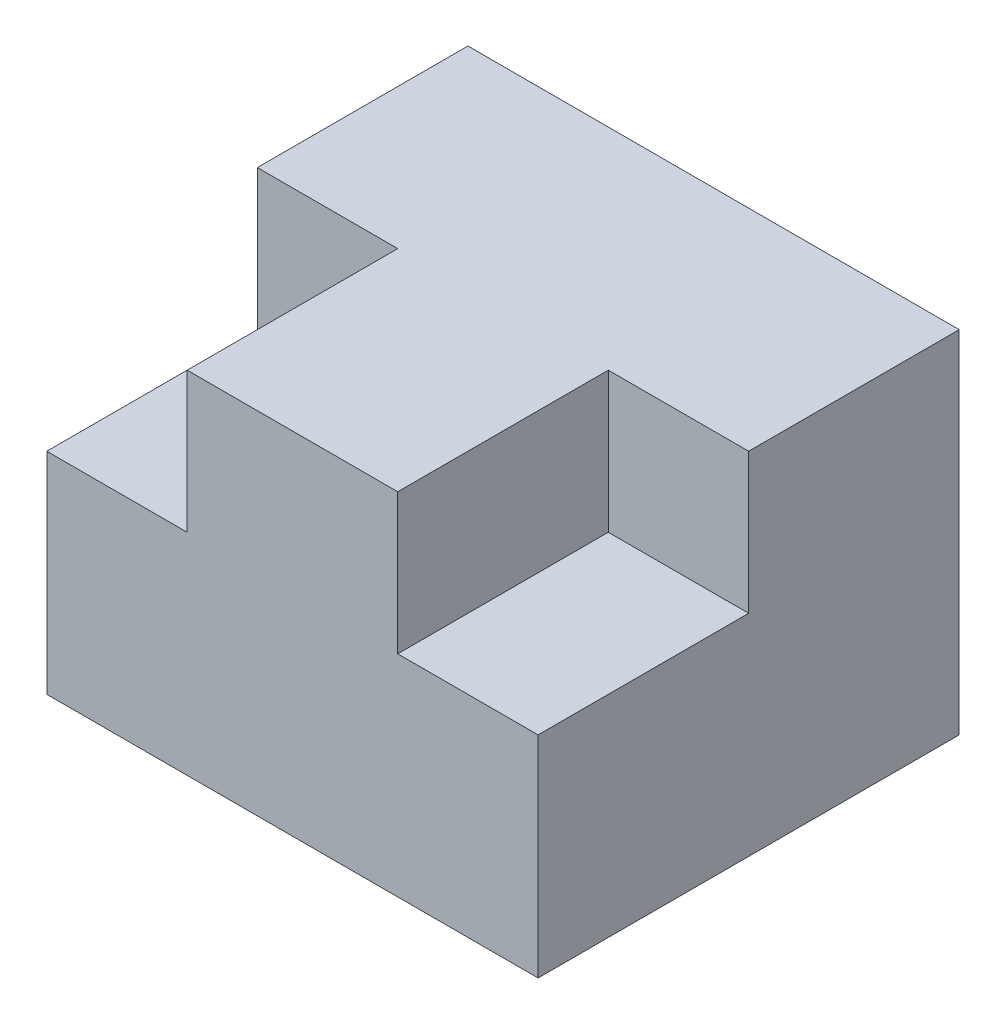
from build123d import *

# Parameters (mm, degrees)
SKETCH1_W           = 35
SKETCH1_H           = 25
BOSS_EXTRUDE1_DEPTH = 15
BOSS_EXTRUDE2_DEPTH = 30


with BuildPart() as part:
    # Sketch1 → Boss-Extrude1 (new body)
    with BuildSketch(Plane.XY):
        with Locations((17.5, 12.5)):
            Rectangle(SKETCH1_W, SKETCH1_H)
    extrude(amount=BOSS_EXTRUDE1_DEPTH)

    # Sketch1<3> → Boss-Extrude2 (add)
    with BuildSketch(Plane.XY):
        Polygon((0, 15), (0, 0), (35, 0), (35, 15), (25, 15), (25, 25), (10, 25), (10, 15), align=None)
    extrude(amount=BOSS_EXTRUDE2_DEPTH)


solid = part.part
